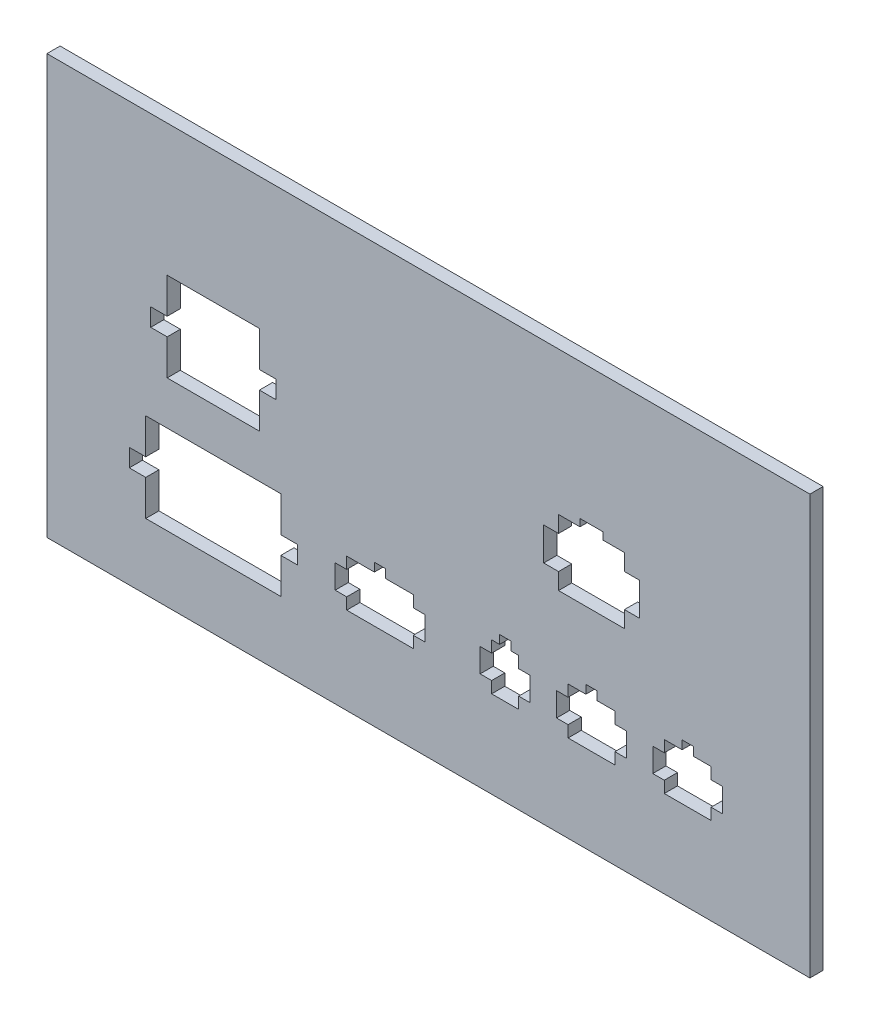
from build123d import *

# Parameters (mm, degrees)
SKETCH1_W           = 105.8
SKETCH1_H           = 53.6
BOSS_EXTRUDE1_DEPTH = 2
SKETCH2_W           = 4.1
SKETCH2_H           = 7.1
SKETCH2_W_2         = 20.5
SKETCH2_H_2         = 13.5
SKETCH2_W_3         = 10
SKETCH2_H_3         = 10
SKETCH2_W_4         = 7.1
SKETCH2_W_5         = 14
SKETCH2_W_6         = 10.1
CUT_EXTRUDE2_DEPTH  = 60.335065518
SKETCH4_W           = 2.5
SKETCH4_H           = 2.7
SKETCH4_W_2         = 1.75
SKETCH4_H_2         = 3.6
SKETCH4_W_3         = 1.7
SKETCH4_H_3         = 1.3
SKETCH4_W_4         = 10.6
SKETCH4_H_4         = 8.4
SKETCH4_W_5         = 3.5
SKETCH4_H_5         = 11.1
SKETCH4_W_6         = 14.5
SKETCH4_H_6         = 5
CUT_EXTRUDE5_DEPTH  = 10
BOSS_EXTRUDE2_DEPTH = 2


with BuildPart() as part:
    # Sketch1 → Boss-Extrude1 (new body)
    with BuildSketch(Plane.XY):
        Rectangle(SKETCH1_W, SKETCH1_H)
    extrude(amount=BOSS_EXTRUDE1_DEPTH)

    # Sketch2 → Cut-Extrude2 (cut, through all)
    with BuildSketch(Plane.XY):
        with Locations((11.65, -10.05)):
            Rectangle(SKETCH2_W, SKETCH2_H)
        with Locations((-32.65, -10.05)):
            Rectangle(SKETCH2_W_2, SKETCH2_H_2)
        with Locations((24.75, 10.05)):
            Rectangle(SKETCH2_W_3, SKETCH2_H_3)
        with Locations((39.35, -10.05)):
            Rectangle(SKETCH2_W_4, SKETCH2_H)
        with Locations((-32.65, 10.05)):
            Rectangle(SKETCH2_W_5, SKETCH2_H_2)
        with Locations((24.75, -10.05)):
            Rectangle(SKETCH2_W_4, SKETCH2_H)
        with Locations((-7.35, -10.05)):
            Rectangle(SKETCH2_W_6, SKETCH2_H)
    extrude(amount=CUT_EXTRUDE2_DEPTH, mode=Mode.SUBTRACT)

    # Sketch4 → Cut-Extrude5 (cut)
    with BuildSketch(Plane.XY.offset(2)):
        with Locations((-24.4, 10.05)):
            Rectangle(SKETCH4_W, SKETCH4_H)
        with Locations((-40.9, 10.05)):
            Rectangle(SKETCH4_W, SKETCH4_H)
        with Locations((-44.15, -10.05)):
            Rectangle(SKETCH4_W, SKETCH4_H)
        with Locations((-21.15, -10.05)):
            Rectangle(SKETCH4_W, SKETCH4_H)
        with Locations((-13.275, -10.05)):
            Rectangle(SKETCH4_W_2, SKETCH4_H_2)
        with Locations((-1.425, -10.05)):
            Rectangle(SKETCH4_W_2, SKETCH4_H_2)
        with Locations((-7.35, -5.85)):
            Rectangle(SKETCH4_W_3, SKETCH4_H_3)
        with Locations((11.65, -5.85)):
            Rectangle(SKETCH4_W_3, SKETCH4_H_3)
        with Locations((14.575, -10.05)):
            Rectangle(SKETCH4_W_2, SKETCH4_H_2)
        with Locations((8.725, -10.05)):
            Rectangle(SKETCH4_W_2, SKETCH4_H_2)
        with Locations((29.175, -10.05)):
            Rectangle(SKETCH4_W_2, SKETCH4_H_2)
        with Locations((20.325, -10.05)):
            Rectangle(SKETCH4_W_2, SKETCH4_H_2)
        with Locations((24.75, -5.85)):
            Rectangle(SKETCH4_W_3, SKETCH4_H_3)
        with Locations((39.35, -10.05)):
            Rectangle(SKETCH4_W_4, SKETCH4_H_2)
        with Locations((39.35, -9.4)):
            Rectangle(SKETCH4_W_3, SKETCH4_H_4)
        with Locations((24.75, 10.6)):
            Rectangle(SKETCH4_W_5, SKETCH4_H_5)
        with Locations((24.75, 10.05)):
            Rectangle(SKETCH4_W_6, SKETCH4_H_6)
    extrude(amount=-CUT_EXTRUDE5_DEPTH, mode=Mode.SUBTRACT)

    # Sketch5 → Boss-Extrude2 (add)
    with BuildSketch(Plane.XY):
        Polygon((-52.9, 26.8), (-52.9, -26.8), (-57.9, -26.8), (-57.9, 36.8), (57.9, 36.8), (57.9, -26.8), (52.9, -26.8), (52.9, 26.8), align=None)
    extrude(amount=BOSS_EXTRUDE2_DEPTH)


solid = part.part
